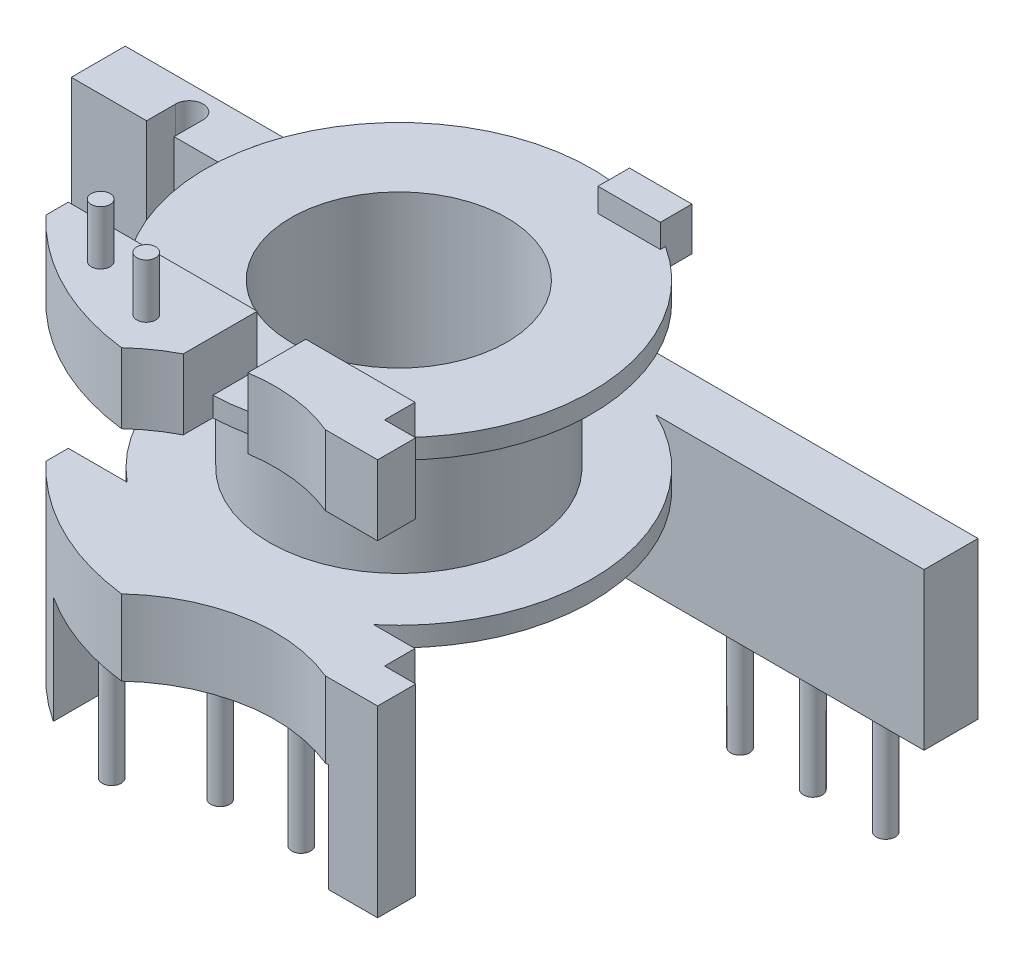
from build123d import *

# Parameters (mm, degrees)
EXTRUDE_1_DEPTH     = 2.6
SKETCH_3_W          = 2.3134287
SKETCH_3_H          = 1.168890291
EXTRUDE_2_DEPTH     = 1.6
EXTRUDE_START       = 6.8
EXTRUDE_3_DEPTH     = 6.8
SKETCH_5_W          = 10.486803681
SKETCH_5_H          = 4.741640899
CUT_EXTRUDE_1_DEPTH = 4
SKETCH_6_R          = 0.35
EXTRUDE_4_DEPTH     = 4.5
SKETCH_7_W          = 31.6
SKETCH_7_H          = 2
EXTRUDE_5_DEPTH     = 5.8
SKETCH_8_R          = 0.35
EXTRUDE_6_DEPTH     = 4.3
SKETCH_9_R          = 0.5
CUT_EXTRUDE_2_DEPTH = 14.3
SKETCH_10_R         = 0.35
EXTRUDE_7_DEPTH     = 2
CUT_EXTRUDE_3_DEPTH = 4


with BuildPart() as part:
    # 草图1 → 旋转1 (revolve)
    with BuildSketch(Plane.XY, mode=Mode.PRIVATE) as revolve_1_sk:
        Polygon((4, 0), (4, -6.75), (7.15, -6.75), (7.15, -6.025), (4.8, -6.025), (4.8, -0.725), (7.15, -0.725), (7.15, 0), align=None)
    revolve(revolve_1_sk.sketch.rotate(Axis((0, 5.836385512, 0), (0, -1, 0)), 90), axis=Axis((0, 5.836385512, 0), (0, -1, 0)))

    # 草图2 → 凸台-拉伸1 (add)
    with BuildSketch(Plane(origin=(0, -0.725, 0), x_dir=(1, 0, 0), z_dir=(0, 1, 0))):
        with BuildLine():
            Line((5.314505692, -8.038664756), (7.251946558, -8.038664756))
            Line((7.251946558, -8.038664756), (7.251946558, -6.627550318))
            Line((7.251946558, -6.627550318), (6.099354415, -6.627550318))
            Line((6.099354415, -6.627550318), (6.099354415, -5.5))
            Line((6.099354415, -5.5), (2.051946558, -5.5))
            Line((2.051946558, -5.5), (2.051946558, -7.649656343))
            ThreePointArc((2.051946558, -7.649656343), (3.710373018, -7.616483358), (5.314505692, -8.038664756))
        make_face()
        with BuildLine():
            Line((-6.748053442, -5.5), (0.251946558, -5.5))
            Line((0.251946558, -5.5), (0.251946558, -8.240596845))
            ThreePointArc((0.251946558, -8.240596845), (-0.452097429, -8.666836759), (-1.091188438, -9.185412772))
            ThreePointArc((-1.091188438, -9.185412772), (-4.172119956, -8.255659578), (-6.748053442, -6.32663218))
            Line((-6.748053442, -6.32663218), (-6.748053442, -5.5))
        make_face()
    extrude(amount=EXTRUDE_1_DEPTH)

    # 草图3 → 凸台-拉伸2 (add)
    with BuildSketch(Plane(origin=(0, -0.725, 0), x_dir=(1, 0, 0), z_dir=(0, 1, 0))):
        with Locations((2.711416285, 6.407720863)):
            Rectangle(SKETCH_3_W, SKETCH_3_H)
    extrude(amount=EXTRUDE_2_DEPTH)

    # 草图4 → 凸台-拉伸3 (add)
    with BuildSketch(Plane.XZ.offset(6.025).offset(EXTRUDE_START)):
        with BuildLine():
            Line((-6.748053442, 6.32663218), (-6.748053442, 5.5))
            Line((-6.748053442, 5.5), (6.099354415, 5.5))
            Line((6.099354415, 5.5), (6.099354415, 6.627550318))
            Line((6.099354415, 6.627550318), (7.251946558, 6.627550318))
            Line((7.251946558, 6.627550318), (7.251946558, 8.038664756))
            Line((7.251946558, 8.038664756), (5.314505692, 8.038664756))
            ThreePointArc((5.314505692, 8.038664756), (1.942688245, 7.668176144), (-1.091188438, 9.185412772))
            ThreePointArc((-1.091188438, 9.185412772), (-4.172119956, 8.255659578), (-6.748053442, 6.32663218))
        make_face()
    extrude(amount=-EXTRUDE_3_DEPTH)

    # 草图5 → 切除-拉伸1 (cut)
    with BuildSketch(Plane.XZ.offset(12.825)):
        with Locations((0.182685526, 7.497044948)):
            Rectangle(SKETCH_5_W, SKETCH_5_H)
    extrude(amount=-CUT_EXTRUDE_1_DEPTH, mode=Mode.SUBTRACT)

    # 草图6 → 凸台-拉伸4 (add)
    with BuildSketch(Plane.XZ.offset(8.825)):
        with Locations(Location((3.019135042, 6.638228249, 0), (0, 0, 270))):
            Circle(SKETCH_6_R)
        with Locations(Location((0.019135042, 6.638228249, 0), (0, 0, 270))):
            Circle(SKETCH_6_R)
        with Locations(Location((-2.66722627, 7.973691801, 0), (0, 0, 270))):
            Circle(SKETCH_6_R)
    extrude(amount=EXTRUDE_4_DEPTH)

    # 草图7 → 凸台-拉伸5 (add)
    with BuildSketch(Plane(origin=(0, -6.025, 0), x_dir=(1, 0, 0), z_dir=(0, 1, 0))):
        with Locations((-2.8, 7.461335244)):
            Rectangle(SKETCH_7_W, SKETCH_7_H)
    extrude(amount=-EXTRUDE_5_DEPTH)

    # 草图8 → 凸台-拉伸6 (add)
    with BuildSketch(Plane.XZ.offset(11.825)):
        with Locations(Location((10.6, -7.444051339, 0), (0, 0, 270))):
            Circle(SKETCH_8_R)
        with Locations(Location((7.9, -7.444051339, 0), (0, 0, 270))):
            Circle(SKETCH_8_R)
        with Locations(Location((5.2, -7.444051339, 0), (0, 0, 270))):
            Circle(SKETCH_8_R)
    extrude(amount=EXTRUDE_6_DEPTH)

    # 草图9 → 切除-拉伸2 (cut)
    with BuildSketch(Plane.XZ.offset(11.825)):
        with Locations(Location((-15.3, -7.538758776, 0), (0, 0, 270))):
            Circle(SKETCH_9_R)
        with Locations(Location((-12.5, -7.538758776, 0), (0, 0, 270))):
            Circle(SKETCH_9_R)
    extrude(amount=-CUT_EXTRUDE_2_DEPTH, mode=Mode.SUBTRACT)

    # 草图10 → 凸台-拉伸7 (add)
    with BuildSketch(Plane(origin=(0, 1.875, 0), x_dir=(1, 0, 0), z_dir=(0, 1, 0))):
        with Locations(Location((-4.248213346, -6.799713472, 0), (0, 0, 270))):
            Circle(SKETCH_10_R)
        with Locations(Location((-1.693600984, -7.663244411, 0), (0, 0, 270))):
            Circle(SKETCH_10_R)
    extrude(amount=EXTRUDE_7_DEPTH)

    # 草图11 → 切除-拉伸3 (cut)
    with BuildSketch(Plane(origin=(0, -6.025, 0), x_dir=(1, 0, 0), z_dir=(0, 1, 0))):
        with BuildLine():
            Line((-14.790486895, 7.538758776), (-14.790486895, 5.844589861))
            ThreePointArc((-14.790486895, 5.844589861), (-15.3, 5.335076756), (-15.809513105, 5.844589861))
            Line((-15.809513105, 5.844589861), (-15.809513105, 7.538758776))
            ThreePointArc((-15.809513105, 7.538758776), (-15.3, 8.048271881), (-14.790486895, 7.538758776))
        make_face()
        with BuildLine():
            Line((-12.019991798, 7.538758776), (-12.019991798, 5.628707126))
            ThreePointArc((-12.019991798, 5.628707126), (-12.5, 5.148698925), (-12.980008202, 5.628707126))
            Line((-12.980008202, 5.628707126), (-12.980008202, 7.538758776))
            ThreePointArc((-12.980008202, 7.538758776), (-12.5, 8.018766978), (-12.019991798, 7.538758776))
        make_face()
    extrude(amount=-CUT_EXTRUDE_3_DEPTH, mode=Mode.SUBTRACT)


solid = part.part
